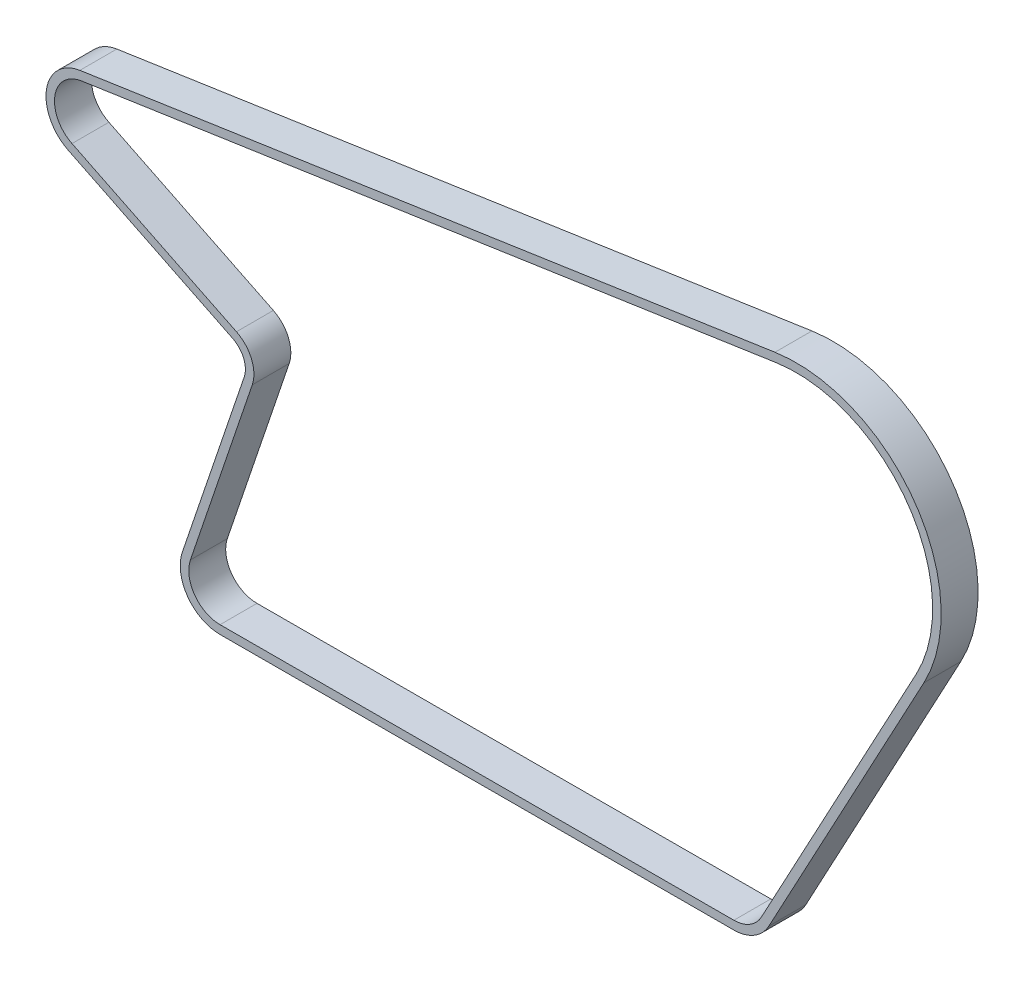
from build123d import *

# Parameters (mm, degrees)
EXTRUDE_THIN1_DEPTH      = 10
EXTRUDE_THIN1_DEPTH_BACK = 3


with BuildPart() as part:
    # Sketch2 → Extrude-Thin1 (new, two sides: drawn at the far end of the back side and taken through both)
    with BuildSketch(Plane.XY.offset(-EXTRUDE_THIN1_DEPTH_BACK)):
        with BuildLine():
            Line((242.697793623, 50.266129876), (-2.060433635, 13.847548997))
            ThreePointArc((-2.060433635, 13.847548997), (-13.833600307, 2.152092613), (-6.16977134, -12.56717636))
            Line((-6.16977134, -12.56717636), (51.739342618, -40.997269268))
            ThreePointArc((51.739342618, -40.997269268), (55.601208684, -45.108400995), (55.790656513, -50.745733973))
            Line((55.790656513, -50.745733973), (34.012493217, -115.021815701))
            ThreePointArc((34.012493217, -115.021815701), (35.902100375, -127.682924287), (47.298057776, -133.514428444))
            Line((47.298057776, -133.514428444), (228.230752902, -133.17848877))
            ThreePointArc((228.230752902, -133.17848877), (235.397453639, -131.189555479), (240.534146402, -125.810722655))
            Line((240.534146402, -125.810722655), (295.117855974, -24.338705573))
            ThreePointArc((295.117855974, -24.338705573), (291.932739821, 29.141852266), (242.697793623, 50.266129876))
        make_face()
        with BuildLine():
            Line((243.139315115, 47.298797948), (-1.618912142, 10.880217069))
            ThreePointArc((-1.618912142, 10.880217069), (-10.869257385, 1.69092991), (-4.847677482, -9.874209997))
            Line((-4.847677482, -9.874209997), (53.061436476, -38.304302905))
            ThreePointArc((53.061436476, -38.304302905), (58.371502316, -43.95710903), (58.631993081, -51.708441875))
            Line((58.631993081, -51.708441875), (36.853829786, -115.984523603))
            ThreePointArc((36.853829786, -115.984523603), (38.338521124, -125.932537492), (47.292487653, -130.514433615))
            Line((47.292487653, -130.514433615), (228.225182779, -130.178493941))
            ThreePointArc((228.225182779, -130.178493941), (233.85616193, -128.615760641), (237.892134815, -124.389534851))
            Line((237.892134815, -124.389534851), (292.475844387, -22.917517769))
            ThreePointArc((292.475844387, -22.917517769), (289.478088008, 27.417124903), (243.139315115, 47.298797948))
        make_face(mode=Mode.SUBTRACT)
    extrude(amount=EXTRUDE_THIN1_DEPTH + EXTRUDE_THIN1_DEPTH_BACK)


solid = part.part
